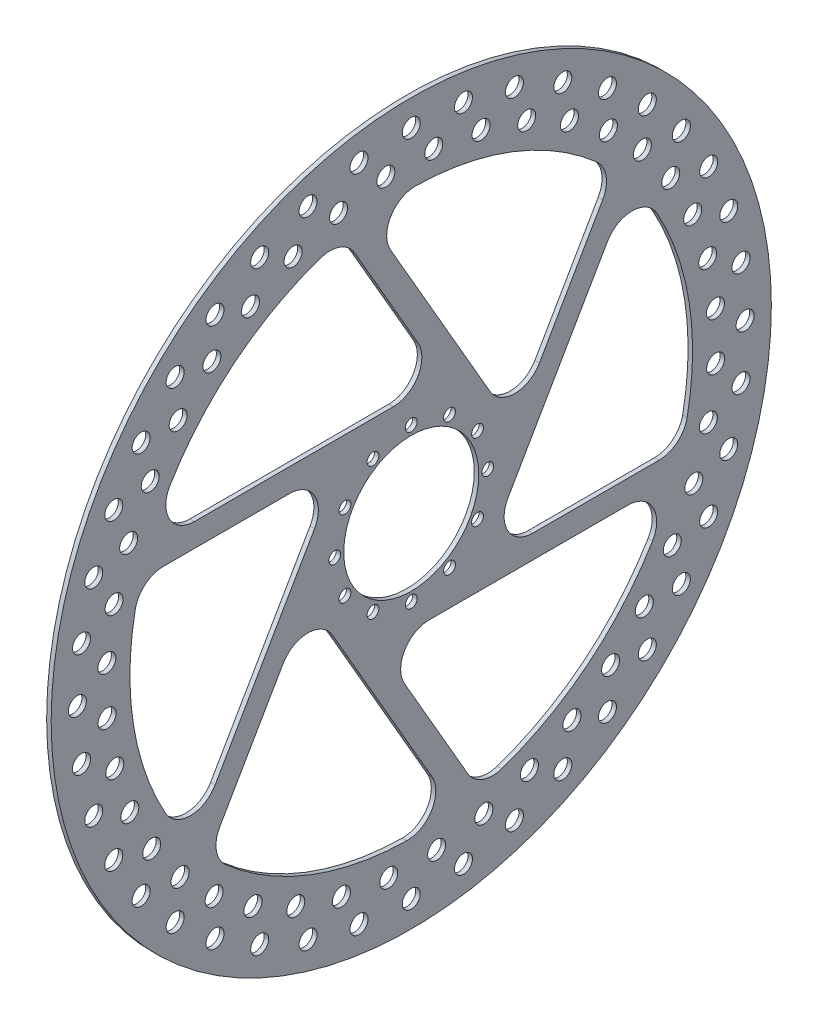
from build123d import *

# Parameters (mm, degrees)
SKETCH1_R           = 160
SKETCH1_R_2         = 4
SKETCH1_R_3         = 2.625
SKETCH1_R_4         = 30
BOSS_EXTRUDE1_DEPTH = 2
FILLET1_R           = 12.7


with BuildPart() as part:
    # Sketch1 → Boss-Extrude1 (new body)
    with BuildSketch(Plane(origin=(0, 0, 0), x_dir=(0, 0, -1), z_dir=(1, 0, 0))):
        Circle(SKETCH1_R)
        with BuildLine():
            Line((-30.068891187, 121.32955857), (14, 45))
            Line((14, 45), (-116.619037897, 45))
            ThreePointArc((-116.619037897, 45), (-82.679426175, 93.750266599), (-30.068891187, 121.32955857))
        make_face(mode=Mode.SUBTRACT)
        with BuildLine():
            Line((45.97114317, 10.375644347), (-19.338375778, 123.495049384))
            ThreePointArc((-19.338375778, 123.495049384), (39.850399399, 118.477616737), (90.040034358, 86.705202917))
            Line((90.040034358, 86.705202917), (45.97114317, 10.375644347))
        make_face(mode=Mode.SUBTRACT)
        with BuildLine():
            Line((31.97114317, -34.624355653), (97.280662119, 78.495049384))
            ThreePointArc((97.280662119, 78.495049384), (122.529825574, 24.727350138), (120.108925545, -34.624355653))
            Line((120.108925545, -34.624355653), (31.97114317, -34.624355653))
        make_face(mode=Mode.SUBTRACT)
        with BuildLine():
            Line((-14, -45), (116.619037897, -45))
            ThreePointArc((116.619037897, -45), (82.679426175, -93.750266599), (30.068891187, -121.32955857))
            Line((30.068891187, -121.32955857), (-14, -45))
        make_face(mode=Mode.SUBTRACT)
        with BuildLine():
            Line((-45.97114317, -10.375644347), (19.338375778, -123.495049384))
            ThreePointArc((19.338375778, -123.495049384), (-39.850399399, -118.477616737), (-90.040034358, -86.705202917))
            Line((-90.040034358, -86.705202917), (-45.97114317, -10.375644347))
        make_face(mode=Mode.SUBTRACT)
        with BuildLine():
            Line((-31.97114317, 34.624355653), (-97.280662119, -78.495049384))
            ThreePointArc((-97.280662119, -78.495049384), (-122.529825574, -24.727350138), (-120.108925545, 34.624355653))
            Line((-120.108925545, 34.624355653), (-31.97114317, 34.624355653))
        make_face(mode=Mode.SUBTRACT)
        with Locations((-87.188145757, -120.004187499)):
            Circle(SKETCH1_R_2, mode=Mode.SUBTRACT)
        with Locations((-120.004187499, -87.188145757)):
            Circle(SKETCH1_R_2, mode=Mode.SUBTRACT)
        with Locations((-104.887505876, -104.887505876)):
            Circle(SKETCH1_R_2, mode=Mode.SUBTRACT)
        with Locations((-87.590662868, -103.545188607)):
            Circle(SKETCH1_R_2, mode=Mode.SUBTRACT)
        with Locations((-102.710312647, -88.568177023)):
            Circle(SKETCH1_R_2, mode=Mode.SUBTRACT)
        with Locations((-45.837520832, -141.07338325)):
            Circle(SKETCH1_R_2, mode=Mode.SUBTRACT)
        with Locations((-67.341924128, -132.165967755)):
            Circle(SKETCH1_R_2, mode=Mode.SUBTRACT)
        with Locations((-51.306447722, -125.54432973)):
            Circle(SKETCH1_R_2, mode=Mode.SUBTRACT)
        with Locations((-23.204445648, -146.507103855)):
            Circle(SKETCH1_R_2, mode=Mode.SUBTRACT)
        with Locations((-31.035320152, -132.024767405)):
            Circle(SKETCH1_R_2, mode=Mode.SUBTRACT)
        with Locations((-10, -135.254317141)):
            Circle(SKETCH1_R_2, mode=Mode.SUBTRACT)
        with Locations((-70.314240273, -115.972574)):
            Circle(SKETCH1_R_2, mode=Mode.SUBTRACT)
        with Locations((-132.165967755, -67.341924128)):
            Circle(SKETCH1_R_2, mode=Mode.SUBTRACT)
        with Locations((-141.07338325, -45.837520832)):
            Circle(SKETCH1_R_2, mode=Mode.SUBTRACT)
        with Locations((-125.052383995, -52.494109789)):
            Circle(SKETCH1_R_2, mode=Mode.SUBTRACT)
        with Locations((-115.300893652, -71.410322981)):
            Circle(SKETCH1_R_2, mode=Mode.SUBTRACT)
        with Locations((-146.507103855, -23.204445648)):
            Circle(SKETCH1_R_2, mode=Mode.SUBTRACT)
        with Locations((-131.724669618, -32.285317396)):
            Circle(SKETCH1_R_2, mode=Mode.SUBTRACT)
        with Locations((-148.333333333, 0)):
            Circle(SKETCH1_R_2, mode=Mode.SUBTRACT)
        with Locations((-135.153456706, -11.28155334)):
            Circle(SKETCH1_R_2, mode=Mode.SUBTRACT)
        with Locations((0, -148.333333333)):
            Circle(SKETCH1_R_2, mode=Mode.SUBTRACT)
        with Locations((23.204445648, -146.507103855)):
            Circle(SKETCH1_R_2, mode=Mode.SUBTRACT)
        with Locations((11.28155334, -135.153456706)):
            Circle(SKETCH1_R_2, mode=Mode.SUBTRACT)
        with Locations((32.285317396, -131.724669618)):
            Circle(SKETCH1_R_2, mode=Mode.SUBTRACT)
        with Locations((45.837520832, -141.07338325)):
            Circle(SKETCH1_R_2, mode=Mode.SUBTRACT)
        with Locations((52.494109789, -125.052383995)):
            Circle(SKETCH1_R_2, mode=Mode.SUBTRACT)
        with Locations((67.341924128, -132.165967755)):
            Circle(SKETCH1_R_2, mode=Mode.SUBTRACT)
        with Locations((71.410322981, -115.300893652)):
            Circle(SKETCH1_R_2, mode=Mode.SUBTRACT)
        with Locations((87.188145757, -120.004187499)):
            Circle(SKETCH1_R_2, mode=Mode.SUBTRACT)
        with Locations((88.568177023, -102.710312647)):
            Circle(SKETCH1_R_2, mode=Mode.SUBTRACT)
        with Locations((104.887505876, -104.887505876)):
            Circle(SKETCH1_R_2, mode=Mode.SUBTRACT)
        with Locations((103.545188607, -87.590662868)):
            Circle(SKETCH1_R_2, mode=Mode.SUBTRACT)
        with Locations((120.004187499, -87.188145757)):
            Circle(SKETCH1_R_2, mode=Mode.SUBTRACT)
        with Locations((115.972574, -70.314240273)):
            Circle(SKETCH1_R_2, mode=Mode.SUBTRACT)
        with Locations((132.165967755, -67.341924128)):
            Circle(SKETCH1_R_2, mode=Mode.SUBTRACT)
        with Locations((125.54432973, -51.306447722)):
            Circle(SKETCH1_R_2, mode=Mode.SUBTRACT)
        with Locations((141.07338325, -45.837520832)):
            Circle(SKETCH1_R_2, mode=Mode.SUBTRACT)
        with Locations((132.024767405, -31.035320152)):
            Circle(SKETCH1_R_2, mode=Mode.SUBTRACT)
        with Locations((146.507103855, -23.204445648)):
            Circle(SKETCH1_R_2, mode=Mode.SUBTRACT)
        with Locations((135.254317141, -10)):
            Circle(SKETCH1_R_2, mode=Mode.SUBTRACT)
        with Locations((-135.254317141, 10)):
            Circle(SKETCH1_R_2, mode=Mode.SUBTRACT)
        with Locations((-146.507103855, 23.204445648)):
            Circle(SKETCH1_R_2, mode=Mode.SUBTRACT)
        with Locations((-132.024767405, 31.035320152)):
            Circle(SKETCH1_R_2, mode=Mode.SUBTRACT)
        with Locations((-141.07338325, 45.837520832)):
            Circle(SKETCH1_R_2, mode=Mode.SUBTRACT)
        with Locations((-125.54432973, 51.306447722)):
            Circle(SKETCH1_R_2, mode=Mode.SUBTRACT)
        with Locations((-132.165967755, 67.341924128)):
            Circle(SKETCH1_R_2, mode=Mode.SUBTRACT)
        with Locations((-115.972574, 70.314240273)):
            Circle(SKETCH1_R_2, mode=Mode.SUBTRACT)
        with Locations((-120.004187499, 87.188145757)):
            Circle(SKETCH1_R_2, mode=Mode.SUBTRACT)
        with Locations((-103.545188607, 87.590662868)):
            Circle(SKETCH1_R_2, mode=Mode.SUBTRACT)
        with Locations((-104.887505876, 104.887505876)):
            Circle(SKETCH1_R_2, mode=Mode.SUBTRACT)
        with Locations((-88.568177023, 102.710312647)):
            Circle(SKETCH1_R_2, mode=Mode.SUBTRACT)
        with Locations((-87.188145757, 120.004187499)):
            Circle(SKETCH1_R_2, mode=Mode.SUBTRACT)
        with Locations((-71.410322981, 115.300893652)):
            Circle(SKETCH1_R_2, mode=Mode.SUBTRACT)
        with Locations((-67.341924128, 132.165967755)):
            Circle(SKETCH1_R_2, mode=Mode.SUBTRACT)
        with Locations((-52.494109789, 125.052383995)):
            Circle(SKETCH1_R_2, mode=Mode.SUBTRACT)
        with Locations((-45.837520832, 141.07338325)):
            Circle(SKETCH1_R_2, mode=Mode.SUBTRACT)
        with Locations((-32.285317396, 131.724669618)):
            Circle(SKETCH1_R_2, mode=Mode.SUBTRACT)
        with Locations((-11.28155334, 135.153456706)):
            Circle(SKETCH1_R_2, mode=Mode.SUBTRACT)
        with Locations((-23.204445648, 146.507103855)):
            Circle(SKETCH1_R_2, mode=Mode.SUBTRACT)
        with Locations((45.837520832, 141.07338325)):
            Circle(SKETCH1_R_2, mode=Mode.SUBTRACT)
        with Locations((102.710312647, 88.568177023)):
            Circle(SKETCH1_R_2, mode=Mode.SUBTRACT)
        with Locations((87.590662868, 103.545188607)):
            Circle(SKETCH1_R_2, mode=Mode.SUBTRACT)
        with Locations((104.887505876, 104.887505876)):
            Circle(SKETCH1_R_2, mode=Mode.SUBTRACT)
        with Locations((120.004187499, 87.188145757)):
            Circle(SKETCH1_R_2, mode=Mode.SUBTRACT)
        with Locations((87.188145757, 120.004187499)):
            Circle(SKETCH1_R_2, mode=Mode.SUBTRACT)
        with Locations((135.153456706, 11.28155334)):
            Circle(SKETCH1_R_2, mode=Mode.SUBTRACT)
        with Locations((148.333333333, 0)):
            Circle(SKETCH1_R_2, mode=Mode.SUBTRACT)
        with Locations((131.724669618, 32.285317396)):
            Circle(SKETCH1_R_2, mode=Mode.SUBTRACT)
        with Locations((146.507103855, 23.204445648)):
            Circle(SKETCH1_R_2, mode=Mode.SUBTRACT)
        with Locations((115.300893652, 71.410322981)):
            Circle(SKETCH1_R_2, mode=Mode.SUBTRACT)
        with Locations((125.052383995, 52.494109789)):
            Circle(SKETCH1_R_2, mode=Mode.SUBTRACT)
        with Locations((141.07338325, 45.837520832)):
            Circle(SKETCH1_R_2, mode=Mode.SUBTRACT)
        with Locations((132.165967755, 67.341924128)):
            Circle(SKETCH1_R_2, mode=Mode.SUBTRACT)
        with Locations((70.314240273, 115.972574)):
            Circle(SKETCH1_R_2, mode=Mode.SUBTRACT)
        with Locations((10, 135.254317141)):
            Circle(SKETCH1_R_2, mode=Mode.SUBTRACT)
        with Locations((31.035320152, 132.024767405)):
            Circle(SKETCH1_R_2, mode=Mode.SUBTRACT)
        with Locations((0, 148.333333333)):
            Circle(SKETCH1_R_2, mode=Mode.SUBTRACT)
        with Locations((23.204445648, 146.507103855)):
            Circle(SKETCH1_R_2, mode=Mode.SUBTRACT)
        with Locations((51.306447722, 125.54432973)):
            Circle(SKETCH1_R_2, mode=Mode.SUBTRACT)
        with Locations((67.341924128, 132.165967755)):
            Circle(SKETCH1_R_2, mode=Mode.SUBTRACT)
        with Locations((0, 34)):
            Circle(SKETCH1_R_3, mode=Mode.SUBTRACT)
        with Locations((-17, -29.444863729)):
            Circle(SKETCH1_R_3, mode=Mode.SUBTRACT)
        with Locations((-29.444863729, -17)):
            Circle(SKETCH1_R_3, mode=Mode.SUBTRACT)
        with Locations((0, -34)):
            Circle(SKETCH1_R_3, mode=Mode.SUBTRACT)
        with Locations((17, -29.444863729)):
            Circle(SKETCH1_R_3, mode=Mode.SUBTRACT)
        with Locations((29.444863729, -17)):
            Circle(SKETCH1_R_3, mode=Mode.SUBTRACT)
        with Locations((-34, 0)):
            Circle(SKETCH1_R_3, mode=Mode.SUBTRACT)
        with Locations((-29.444863729, 17)):
            Circle(SKETCH1_R_3, mode=Mode.SUBTRACT)
        with Locations((-17, 29.444863729)):
            Circle(SKETCH1_R_3, mode=Mode.SUBTRACT)
        Circle(SKETCH1_R_4, mode=Mode.SUBTRACT)
        with Locations((34, 0)):
            Circle(SKETCH1_R_3, mode=Mode.SUBTRACT)
        with Locations((29.444863729, 17)):
            Circle(SKETCH1_R_3, mode=Mode.SUBTRACT)
        with Locations((17, 29.444863729)):
            Circle(SKETCH1_R_3, mode=Mode.SUBTRACT)
    extrude(amount=BOSS_EXTRUDE1_DEPTH)

    # Fillet1
    fillet1_edges = [part.edges().sort_by_distance(p)[0] for p in [
        (1, 45, 116.619037897),
        (1, 121.32955857, 30.068891187),
        (1, 45, -14),
        (1, 86.705202917, -90.040034358),
        (1, 10.375644347, -45.97114317),
        (1, 123.495049384, 19.338375778),
        (1, 78.495049384, -97.280662119),
        (1, -34.624355653, -31.97114317),
        (1, -34.624355653, -120.108925545),
        (1, -45, -116.619037897),
        (1, -45, 14),
        (1, -121.32955857, -30.068891187),
        (1, -123.495049384, -19.338375778),
        (1, -10.375644347, 45.97114317),
        (1, -86.705202917, 90.040034358),
        (1, -78.495049384, 97.280662119),
        (1, 34.624355653, 120.108925545),
        (1, 34.624355653, 31.97114317),
    ]]
    fillet(fillet1_edges, radius=FILLET1_R)


solid = part.part
